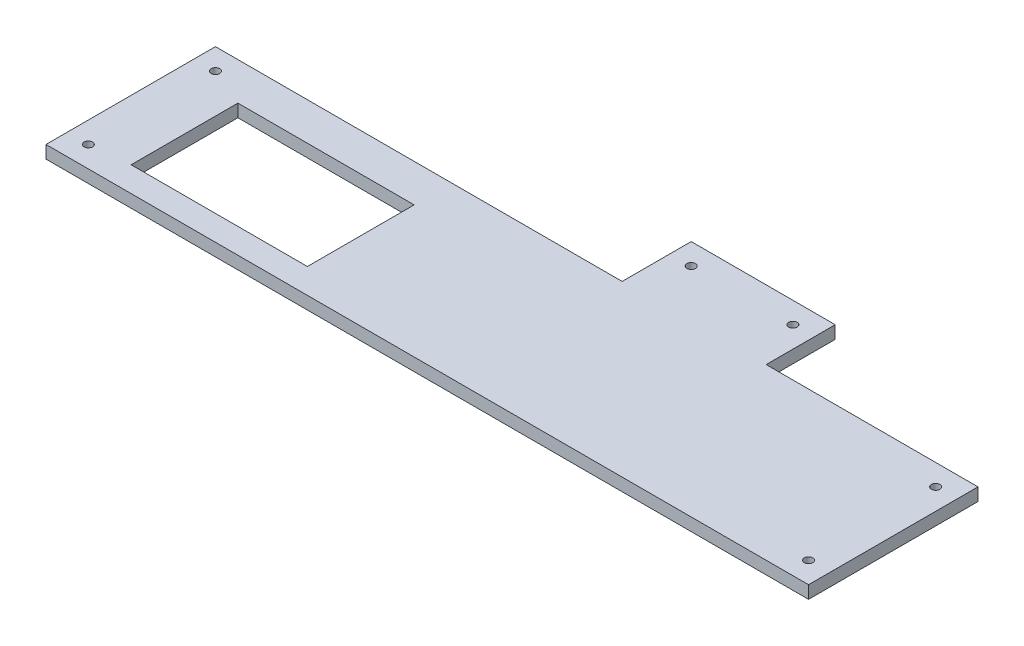
from build123d import *

# Parameters (mm, degrees)
SKETCH1_W              = 900
SKETCH1_H              = 200
SKETCH1_R              = 5
BOSS_EXTRUDE1_DEPTH    = 15
SKETCH2_W              = 208
SKETCH2_H              = 126
SHREDDER_OPENING_DEPTH = 462.221205063
SKETCH3_W              = 170
SKETCH3_H              = 81.5
SKETCH3_R              = 5
LEGS_ADD_ON_DEPTH      = 15


with BuildPart() as part:
    # Sketch1 → Boss-Extrude1 (new body)
    with BuildSketch(Plane(origin=(0, 0, 0), x_dir=(1, 0, 0), z_dir=(0, 1, 0))):
        Rectangle(SKETCH1_W, SKETCH1_H)
        with Locations(Location((425, -75, 0), (0, 0, 270))):
            Circle(SKETCH1_R, mode=Mode.SUBTRACT)
        with Locations(Location((425, 75, 0), (0, 0, 270))):
            Circle(SKETCH1_R, mode=Mode.SUBTRACT)
        with Locations(Location((-425, -75, 0), (0, 0, 270))):
            Circle(SKETCH1_R, mode=Mode.SUBTRACT)
        with Locations(Location((-425, 75, 0), (0, 0, 270))):
            Circle(SKETCH1_R, mode=Mode.SUBTRACT)
    extrude(amount=-BOSS_EXTRUDE1_DEPTH)

    # Sketch2 → Shredder Opening (cut, through all)
    with BuildSketch(Plane.XZ.offset(15)):
        with Locations((-275, 7.5)):
            Rectangle(SKETCH2_W, SKETCH2_H)
    extrude(amount=-SHREDDER_OPENING_DEPTH, mode=Mode.SUBTRACT)

    # Sketch3 → Legs add on (add, through all)
    with BuildSketch(Plane(origin=(0, 0, 0), x_dir=(1, 0, 0), z_dir=(0, 1, 0))):
        with Locations((115, 140.75)):
            Rectangle(SKETCH3_W, SKETCH3_H)
        with Locations(Location((175, 156.5, 0), (0, 0, 270))):
            Circle(SKETCH3_R, mode=Mode.SUBTRACT)
        with Locations(Location((55, 156.5, 0), (0, 0, 90))):
            Circle(SKETCH3_R, mode=Mode.SUBTRACT)
    extrude(amount=-LEGS_ADD_ON_DEPTH)


solid = part.part
